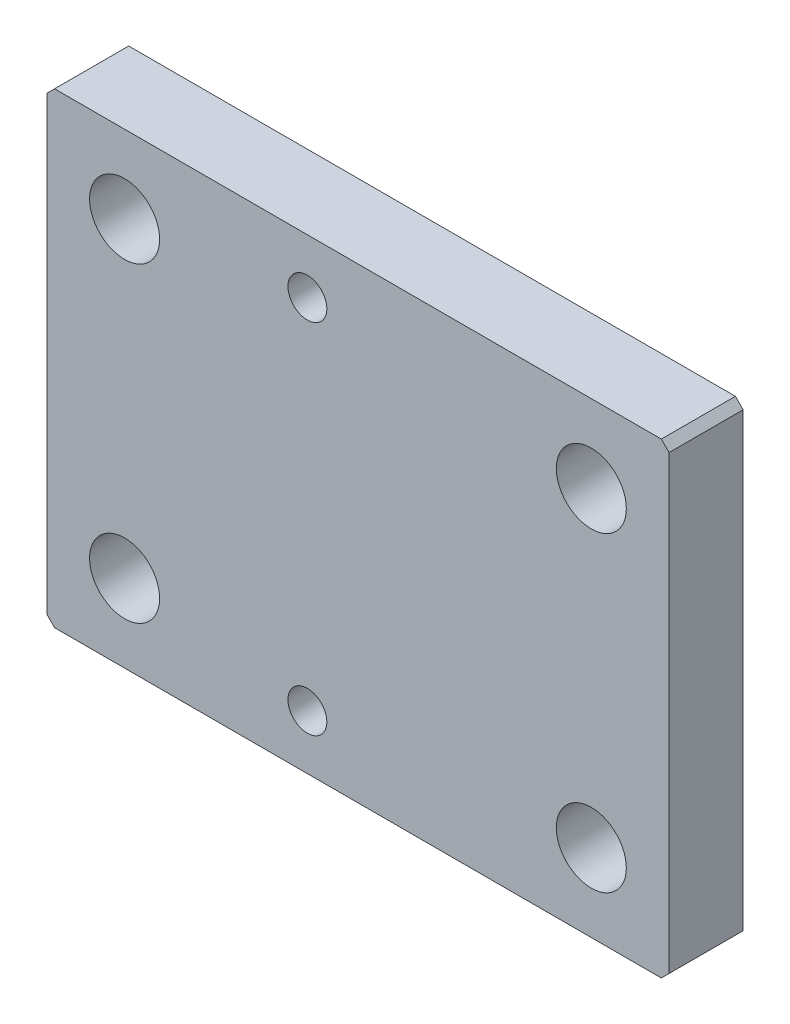
from build123d import *

# Parameters (mm, degrees)
SKETCH1_W             = 80
SKETCH1_H             = 60
BOSS_EXTRUDE1_DEPTH   = 4.7625
M8_CLEARANCE_HOLE1_D  = 9
M6X1_0_TAPPED_HOLE2_D = 5
CHAMFER1_SIZE         = 1


with BuildPart() as part:
    # Sketch1 → Boss-Extrude1 (new, symmetric)
    with BuildSketch(Plane.XY):
        Rectangle(SKETCH1_W, SKETCH1_H)
    extrude(amount=BOSS_EXTRUDE1_DEPTH, both=True)

    # M8 Clearance Hole1 (through all)
    with Locations(Plane.XY.offset(4.7625)):
        with Locations((-30, 20), (30, 20), (30, -20), (-30, -20)):
            Hole(M8_CLEARANCE_HOLE1_D / 2)

    # M6x1.0 Tapped Hole2 (through all)
    with Locations(Plane.XY.offset(4.7625)):
        with Locations((-6.5, 23), (-6.5, -23)):
            Hole(M6X1_0_TAPPED_HOLE2_D / 2)

    # Chamfer1
    chamfer1_edges = [part.edges().sort_by_distance(p)[0] for p in [
        (-40, 30, 0),
        (40, 30, 0),
        (40, -30, 0),
        (-40, -30, 0),
    ]]
    chamfer(chamfer1_edges, length=CHAMFER1_SIZE)


solid = part.part
